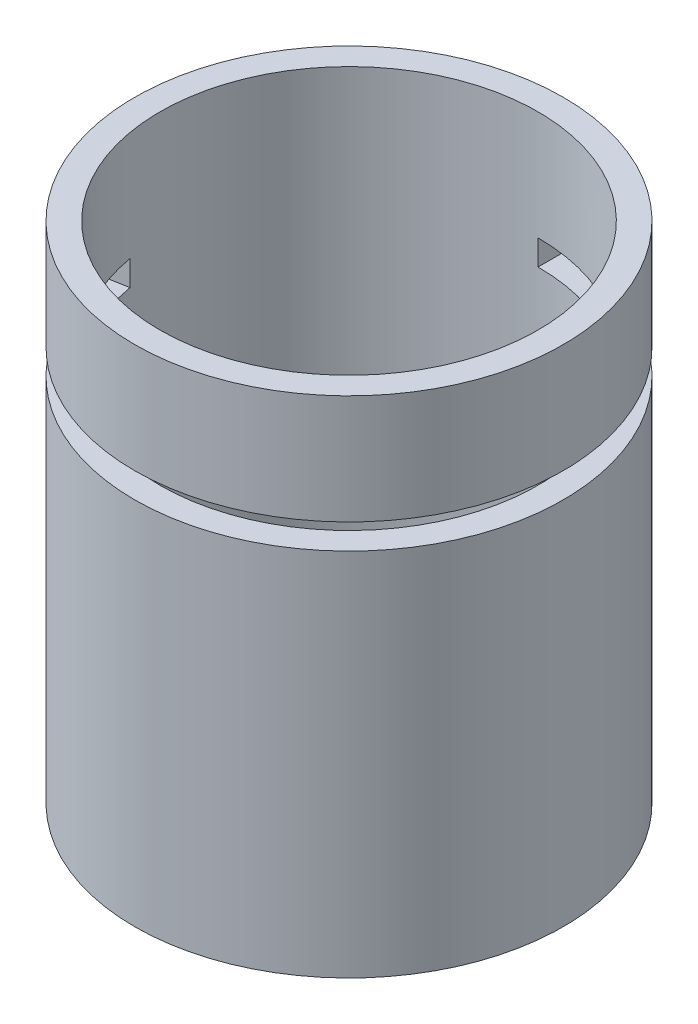
from build123d import *

# Parameters (mm, degrees)
SKETCH_1_R          = 25.5
SKETCH_1_R_2        = 22.5
EXTRUDE_1_DEPTH     = 60
SKETCH_2_W          = 46.809184836
SKETCH_2_H          = 3
CUT_REVOLVE_1_ANGLE = 260


with BuildPart() as part:
    # 草图1 → 凸台-拉伸1 (new body)
    with BuildSketch(Plane(origin=(0, 0, 0), x_dir=(1, 0, 0), z_dir=(0, 1, 0))):
        Circle(SKETCH_1_R)
        Circle(SKETCH_1_R_2, mode=Mode.SUBTRACT)
    extrude(amount=EXTRUDE_1_DEPTH)

    # 草图2 → 切除-旋转1 (revolve, cut)
    with BuildSketch(Plane(origin=(0, 0, 0), x_dir=(0, 0, -1), z_dir=(1, 0, 0))):
        with Locations((23.404592418, 45.5)):
            Rectangle(SKETCH_2_W, SKETCH_2_H)
    revolve(axis=Axis((0, 60.338123586, 0), (0, -1, 0)), revolution_arc=CUT_REVOLVE_1_ANGLE, mode=Mode.SUBTRACT)


solid = part.part
